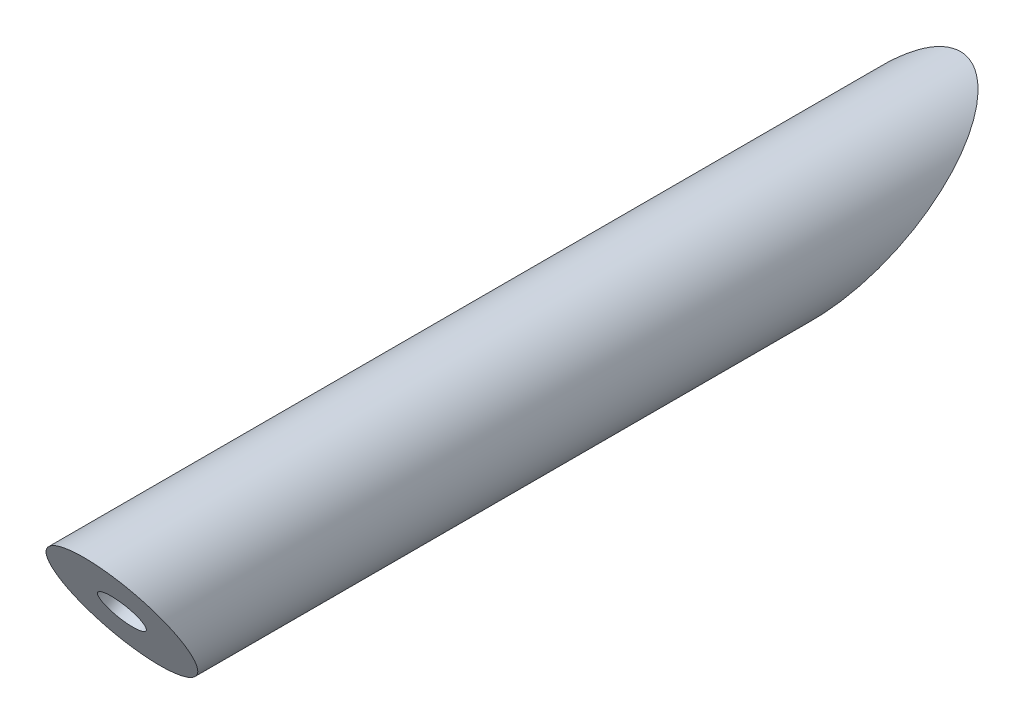
from build123d import *

# Parameters (mm, degrees)
SKETCH2_R               = 7.5
BOSS_EXTRUDE1_DEPTH     = 100
CUT_EXTRUDE1_DEPTH      = 101.560926806
CUT_EXTRUDE1_DEPTH_BACK = 101.560926806
SKETCH4_R               = 2.5
CUT_EXTRUDE2_DEPTH      = 10
SKETCH5_R               = 2.5
CUT_EXTRUDE3_DEPTH      = 5


with BuildPart() as part:
    # Sketch2 → Boss-Extrude1 (new body)
    with BuildSketch(Plane.XY):
        Circle(SKETCH2_R)
    extrude(amount=BOSS_EXTRUDE1_DEPTH)

    # Sketch3 → Cut-Extrude1 (cut, two sides: drawn at the far end of the back side and taken through both)
    with BuildSketch(Plane(origin=(0, 0, 0), x_dir=(0, 0, -1), z_dir=(1, 0, 0)).offset(-CUT_EXTRUDE1_DEPTH_BACK)):
        Polygon((-100, 7.5), (-86.572214113, -15.75760739), (-93.968196495, -20.02767981), (-105.531182824, 0), align=None)
        Polygon((0, 7.5), (-26.836822614, -7.99424676), (-23.788631199, -13.273869162), (1.512017142, -9.243577121), (5.324456029, -3.175017221), align=None)
    extrude(amount=CUT_EXTRUDE1_DEPTH + CUT_EXTRUDE1_DEPTH_BACK, mode=Mode.SUBTRACT)

    # Sketch4 → Cut-Extrude2 (cut)
    with BuildSketch(Plane(origin=(0, -41.426270189, 71.752404736), x_dir=(1, 0, 0), z_dir=(0, -0.5000000000000044, 0.866025403784436))):
        with Locations(Location((0, 47.834936491, 0), (0, 0, 270))):
            Circle(SKETCH4_R)
    extrude(amount=-CUT_EXTRUDE2_DEPTH, mode=Mode.SUBTRACT)

    # Sketch5 → Cut-Extrude3 (cut)
    with BuildSketch(Plane(origin=(0, 5.625, 3.247595264), x_dir=(1, 0, 0), z_dir=(0, -0.8660254037844386, -0.4999999999999999))):
        with Locations(Location((0, 11.25, 0), (0, 0, 270))):
            Circle(SKETCH5_R)
    extrude(amount=-CUT_EXTRUDE3_DEPTH, mode=Mode.SUBTRACT)


solid = part.part
